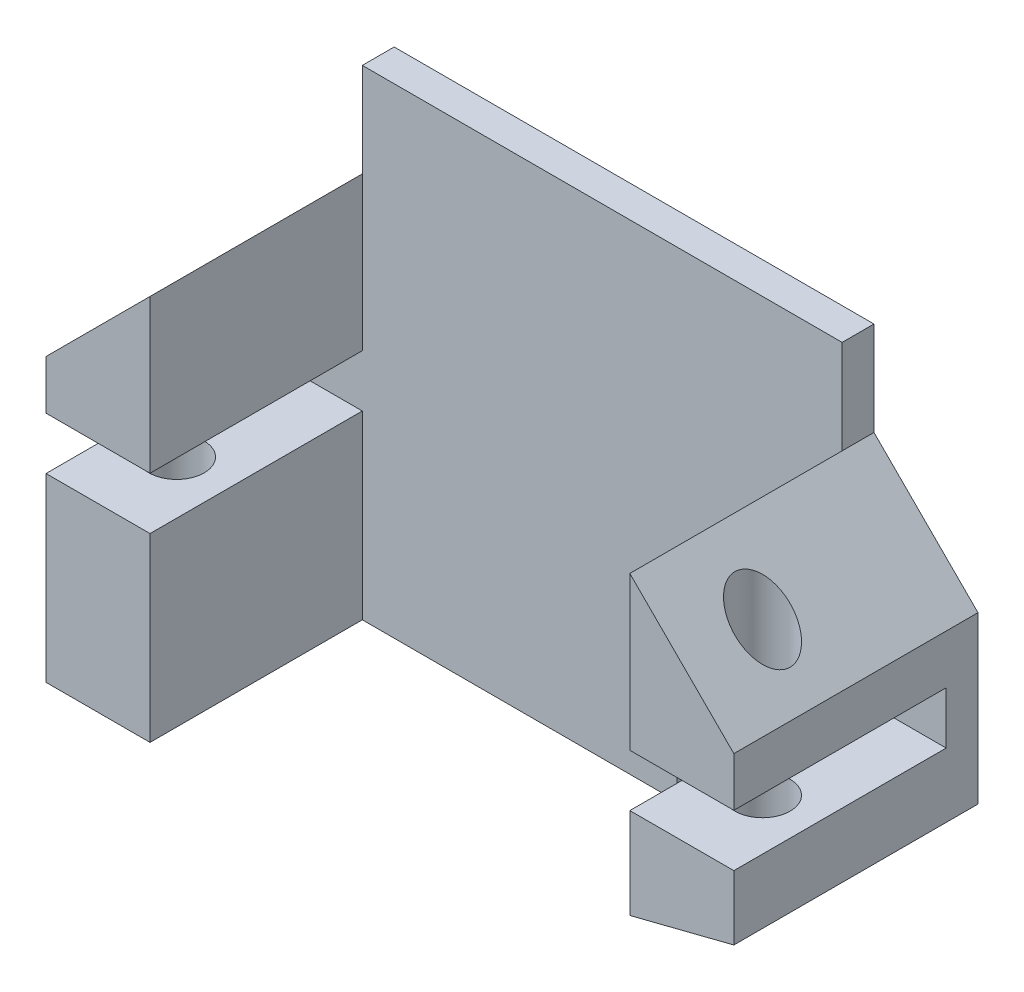
from build123d import *

# Parameters (mm, degrees)
SKETCH_1_W          = 32.4
SKETCH_1_H          = 30
EXTRUDE_1_DEPTH     = 1.5
SKETCH_2_W          = 4.9
SKETCH_2_H          = 8.52
EXTRUDE_2_DEPTH     = 10
CUT_EXTRUDE_1_DEPTH = 11.5
SKETCH_4_R          = 1.3
CUT_EXTRUDE_2_DEPTH = 31.5


with BuildPart() as part:
    # 草图1 → 凸台-拉伸1 (new body)
    with BuildSketch(Plane.XY):
        with Locations((-0.362675268, 2.133428793)):
            Rectangle(SKETCH_1_W, SKETCH_1_H)
    extrude(amount=EXTRUDE_1_DEPTH)

    # 草图2 → 凸台-拉伸2 (add)
    with BuildSketch(Plane.XY.offset(1.5)):
        with Locations((-14.112675268, -1.225199495)):
            Rectangle(SKETCH_2_W, SKETCH_2_H)
        Polygon((-16.562675268, 5.494800505), (-11.662675268, 5.494800505), (-11.662675268, 12.70812694), (-16.562675268, 7.80812694), align=None)
        Polygon((10.937324732, 5.494800505), (10.937324732, 12.70812694), (15.837324732, 7.80812694), (15.837324732, 5.494800505), align=None)
        Polygon((10.937324732, 3.034800505), (15.837324732, 3.034800505), (15.837324732, 0), (10.937324732, -1.245199495), align=None)
    extrude(amount=EXTRUDE_2_DEPTH)

    # 草图3 → 切除-拉伸1 (cut)
    with BuildSketch(Plane.XY.offset(1.5)):
        Polygon((-16.562675268, 7.80812694), (-11.662675268, 12.70812694), (-11.662675268, 17.133428793), (-16.562675268, 17.133428793), align=None)
        Polygon((15.837324732, 7.80812694), (10.937324732, 12.70812694), (10.937324732, 17.133428793), (15.837324732, 17.133428793), align=None)
        Polygon((-16.562675268, -12.866571207), (-16.562675268, -8.702000753), (-16.562675268, -5.485199495), (3.157324732, -5.485199495), (3.157324732, -1.245199495), (10.937324732, -1.245199495), (15.837324732, 0), (15.837324732, -12.866571207), align=None)
    extrude(amount=-CUT_EXTRUDE_1_DEPTH, mode=Mode.SUBTRACT)

    # 草图4 → 切除-拉伸2 (cut)
    with BuildSketch(Plane.XZ.offset(5.485199495)):
        with Locations(Location((-14.162675268, 7.75, 0), (0, 0, 180))):
            Circle(SKETCH_4_R)
        with Locations(Location((13.437324732, 7.75, 0), (0, 0, 270))):
            Circle(SKETCH_4_R)
    extrude(amount=-CUT_EXTRUDE_2_DEPTH, mode=Mode.SUBTRACT)


solid = part.part
